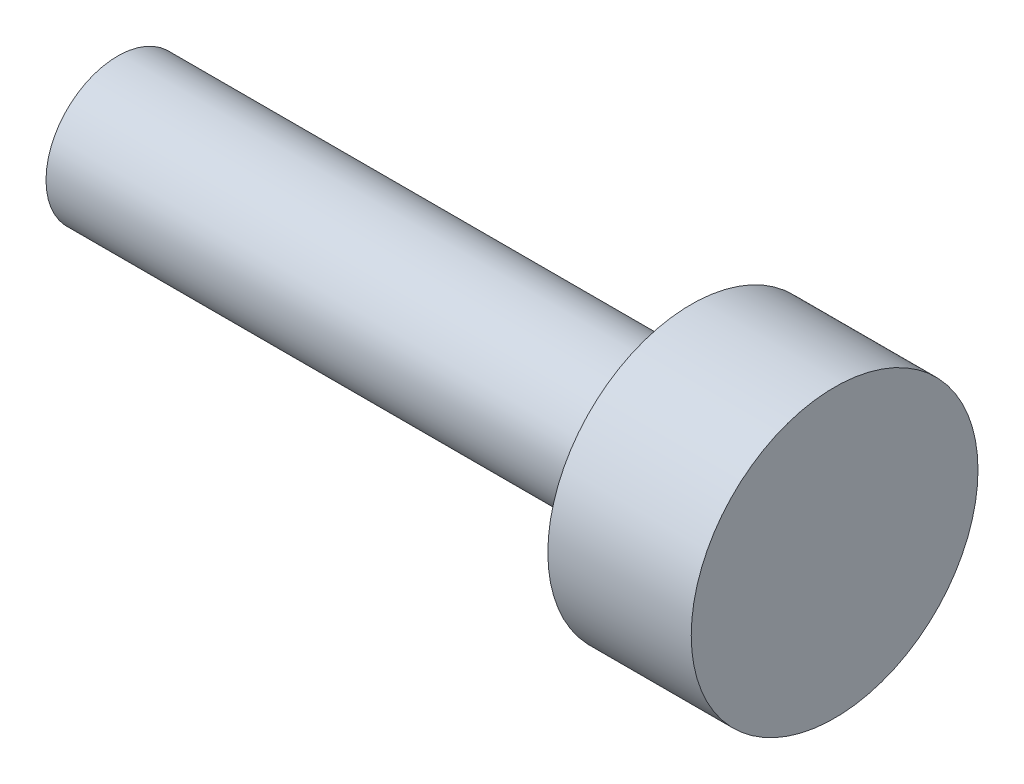
from build123d import *

# Parameters (mm, degrees)
SKETCH2_W          = 2.386092155
SKETCH2_H          = 2.248872797
CUT_EXTRUDE1_DEPTH = 3


with BuildPart() as part:
    # Sketch1 → Revolve1 (revolve)
    with BuildSketch(Plane.XY, mode=Mode.PRIVATE) as revolve1_sk:
        Polygon((-116.835752997, 27.175404574), (-105.835752997, 27.175404574), (-105.835752997, 28.175404574), (-103.835752997, 28.175404574), (-103.835752997, 26.175404574), (-116.835752997, 26.175404574), align=None)
    revolve(revolve1_sk.sketch.rotate(Axis((-116.835752997, 26.175404574, 0), (1, 0, 0)), 90), axis=Axis((-116.835752997, 26.175404574, 0), (1, 0, 0)))

    # Sketch2 → Cut-Extrude1 (cut)
    with BuildSketch(Plane.ZY.offset(116.835752997)):
        with Locations((0.019058245, 26.198274467)):
            Rectangle(SKETCH2_W, SKETCH2_H)
    extrude(amount=-CUT_EXTRUDE1_DEPTH, mode=Mode.SUBTRACT)


solid = part.part
